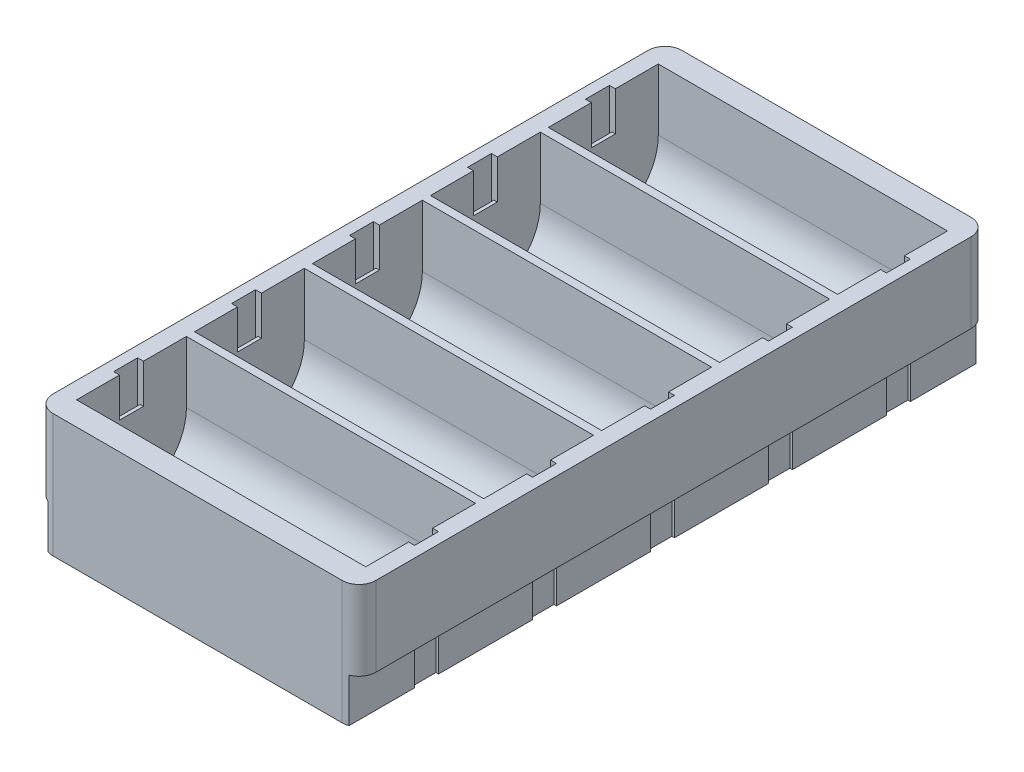
from build123d import *

# Parameters (mm, degrees)
SKETCH_241_W                = 95.8
SKETCH_241_H                = 36.6
EXTRUDE_326_DEPTH           = 36.6
CUT_EXTRUDE_START           = -5
SKETCH_380_R                = 16.3
CUT_EXTRUDE_539_DEPTH       = 85.8
SKETCH_588_W                = 85.8
SKETCH_588_H                = 32.6
CUT_EXTRUDE_850_DEPTH       = 18.3
CUT_EXTRUDE_1245_DEPTH      = 109.888750567
CUT_EXTRUDE_1245_DEPTH_BACK = 109.888750567
SKETCH_902_W                = 0.75
SKETCH_902_H                = 7.1
SKETCH_A_W                  = 7.1
SKETCH_A_H                  = 11.6
CUT_EXTRUDE_A_DEPTH         = 1
SKETCH_B_W                  = 7.1
SKETCH_B_H                  = 11.6
CUT_EXTRUDE_B_DEPTH         = 1
SKETCH_1779_W               = 81.8
SKETCH_1779_H               = 16.6
CUT_EXTRUDE_2059_DEPTH      = 109.888750567
SKETCH_2105_W               = 3.25
SKETCH_2105_H               = 13.1
CUT_EXTRUDE_2527_DEPTH      = 13
PATTERN_LINEAR_2584_COUNT   = 5
PATTERN_LINEAR_2584_PITCH   = 35
SKETCH_2694_W               = 95.8
SKETCH_2694_H               = 36.6
EXTRUDE_2884_DEPTH          = 5
SKETCH_2964_W               = 95.8
SKETCH_2964_H               = 36.6
EXTRUDE_3079_DEPTH          = 5
FILLET_1_R                  = 5
FILLET_2_R                  = 5
FILLET_3_R                  = 5
FILLET_4_R                  = 5
SKETCH_3561_W               = 186.6
SKETCH_3561_H               = 13
CUT_EXTRUDE_3822_DEPTH      = 3.25
SKETCH_4173_W               = 186.6
SKETCH_4173_H               = 13
CUT_EXTRUDE_4352_DEPTH      = 3.25


with BuildPart() as part:
    # Sketch 241 → Extrude 326 (new body)
    with BuildSketch(Plane(origin=(0, 0, 0), x_dir=(1, 0, 0), z_dir=(0, 1, 0))):
        with Locations((-47.9, 18.3)):
            Rectangle(SKETCH_241_W, SKETCH_241_H)
    extrude(amount=EXTRUDE_326_DEPTH)

    # Sketch 380 → Cut-Extrude 539 (cut)
    with BuildSketch(Plane(origin=(0, 0, 0), x_dir=(0, 0, -1), z_dir=(1, 0, 0)).offset(CUT_EXTRUDE_START)):
        with Locations((18.3, 18.3)):
            Circle(SKETCH_380_R)
    extrude(amount=-CUT_EXTRUDE_539_DEPTH, mode=Mode.SUBTRACT)

    # Sketch 588 → Cut-Extrude 850 (cut)
    with BuildSketch(Plane(origin=(0, 36.6, 0), x_dir=(1, 0, 0), z_dir=(0, 1, 0))):
        with Locations((-47.9, 18.3)):
            Rectangle(SKETCH_588_W, SKETCH_588_H)
    extrude(amount=-CUT_EXTRUDE_850_DEPTH, mode=Mode.SUBTRACT)

    # Sketch 902 → Cut-Extrude 1245 (cut, two sides: drawn at the far end of the back side and taken through both)
    with BuildSketch(Plane(origin=(0, 36.6, 0), x_dir=(1, 0, 0), z_dir=(0, 1, 0)).offset(-CUT_EXTRUDE_1245_DEPTH_BACK)):
        with Locations((-92.175, 18.3)):
            Rectangle(SKETCH_902_W, SKETCH_902_H)
        with Locations((-3.625, 18.3)):
            Rectangle(SKETCH_902_W, SKETCH_902_H)
    extrude(amount=CUT_EXTRUDE_1245_DEPTH + CUT_EXTRUDE_1245_DEPTH_BACK, mode=Mode.SUBTRACT)

    # 触点开窗面A → 触点开窗A (cut)
    with BuildSketch(Plane(origin=(-90.8, 0, 0), x_dir=(0, 0, -1), z_dir=(1, 0, 0))):
        with Locations((18.3, 30.8)):
            Rectangle(SKETCH_A_W, SKETCH_A_H)
    extrude(amount=-CUT_EXTRUDE_A_DEPTH, mode=Mode.SUBTRACT)

    # 触点开窗面B → 触点开窗B (cut)
    with BuildSketch(Plane.ZY.offset(5)):
        with Locations((-18.3, 30.8)):
            Rectangle(SKETCH_B_W, SKETCH_B_H)
    extrude(amount=-CUT_EXTRUDE_B_DEPTH, mode=Mode.SUBTRACT)

    # Sketch 1779 → Cut-Extrude 2059 (cut, through all)
    with BuildSketch(Plane.XZ):
        with Locations((-47.9, -18.3)):
            Rectangle(SKETCH_1779_W, SKETCH_1779_H)
    extrude(amount=-CUT_EXTRUDE_2059_DEPTH, mode=Mode.SUBTRACT)

    # Sketch 2105 → Cut-Extrude 2527 (cut)
    with BuildSketch(Plane.XZ):
        with Locations((-94.175, -18.3)):
            Rectangle(SKETCH_2105_W, SKETCH_2105_H)
        with Locations((-1.625, -18.3)):
            Rectangle(SKETCH_2105_W, SKETCH_2105_H)
    extrude(amount=-CUT_EXTRUDE_2527_DEPTH, mode=Mode.SUBTRACT)


with BuildPart() as pattern_linear_2584_1:
    # Pattern Linear 2584: pattern copy
    add(part.part.moved(Location(Vector(0, 0, -1) * (1 * PATTERN_LINEAR_2584_PITCH))))


with BuildPart() as pattern_linear_2584_2:
    # Pattern Linear 2584: pattern copy
    add(part.part.moved(Location(Vector(0, 0, -1) * (2 * PATTERN_LINEAR_2584_PITCH))))


with BuildPart() as pattern_linear_2584_3:
    # Pattern Linear 2584: pattern copy
    add(part.part.moved(Location(Vector(0, 0, -1) * (3 * PATTERN_LINEAR_2584_PITCH))))


with BuildPart() as pattern_linear_2584_4:
    # Pattern Linear 2584: pattern copy
    add(part.part.moved(Location(Vector(0, 0, -1) * (4 * PATTERN_LINEAR_2584_PITCH))))

    # Sketch 2694 → Extrude 2884 (add)
    with BuildSketch(Plane(origin=(0, 0, -176.6), x_dir=(-1, 0, 0), z_dir=(0, 0, -1))):
        with Locations((47.9, 18.3)):
            Rectangle(SKETCH_2694_W, SKETCH_2694_H)
    extrude(amount=EXTRUDE_2884_DEPTH)

    # 圆角3
    fillet_3_edges = [pattern_linear_2584_4.edges().sort_by_distance(p)[0] for p in [
        (-95.8, 18.3, -181.6),
    ]]
    fillet(fillet_3_edges, radius=FILLET_3_R)

    # 圆角4
    fillet_4_edges = [pattern_linear_2584_4.edges().sort_by_distance(p)[0] for p in [
        (0, 18.3, -181.6),
    ]]
    fillet(fillet_4_edges, radius=FILLET_4_R)


with BuildPart() as part_1:
    add(part.part)

    # Sketch 2964 → Extrude 3079 (add)
    with BuildSketch(Plane.XY):
        with Locations((-47.9, 18.3)):
            Rectangle(SKETCH_2964_W, SKETCH_2964_H)
    extrude(amount=EXTRUDE_3079_DEPTH)

    # 圆角1
    fillet_1_edges = [part_1.edges().sort_by_distance(p)[0] for p in [
        (-95.8, 18.3, 5),
    ]]
    fillet(fillet_1_edges, radius=FILLET_1_R)

    # 圆角2
    fillet_2_edges = [part_1.edges().sort_by_distance(p)[0] for p in [
        (0, 18.3, 5),
    ]]
    fillet(fillet_2_edges, radius=FILLET_2_R)


with BuildPart() as cut_extrude_3822_tool:
    # Sketch 3561 → Cut-Extrude 3822 (new body)
    with BuildSketch(Plane.ZY.offset(95.8)):
        with Locations((-88.3, 6.5)):
            Rectangle(SKETCH_3561_W, SKETCH_3561_H)
    extrude(amount=-CUT_EXTRUDE_3822_DEPTH)


with BuildPart() as part_2:
    add(part_1.part)

    # Cut-Extrude 3822: cut by cut_extrude_3822_tool
    add(cut_extrude_3822_tool.part, mode=Mode.SUBTRACT)


with BuildPart() as pattern_linear_2584_1_1:
    add(pattern_linear_2584_1.part)

    # Cut-Extrude 3822: cut by cut_extrude_3822_tool
    add(cut_extrude_3822_tool.part, mode=Mode.SUBTRACT)


with BuildPart() as pattern_linear_2584_2_1:
    add(pattern_linear_2584_2.part)

    # Cut-Extrude 3822: cut by cut_extrude_3822_tool
    add(cut_extrude_3822_tool.part, mode=Mode.SUBTRACT)


with BuildPart() as pattern_linear_2584_3_1:
    add(pattern_linear_2584_3.part)

    # Cut-Extrude 3822: cut by cut_extrude_3822_tool
    add(cut_extrude_3822_tool.part, mode=Mode.SUBTRACT)


with BuildPart() as pattern_linear_2584_4_1:
    add(pattern_linear_2584_4.part)

    # Cut-Extrude 3822: cut by cut_extrude_3822_tool
    add(cut_extrude_3822_tool.part, mode=Mode.SUBTRACT)


with BuildPart() as cut_extrude_4352_tool:
    # Sketch 4173 → Cut-Extrude 4352 (new body)
    with BuildSketch(Plane(origin=(0, 0, 0), x_dir=(0, 0, -1), z_dir=(1, 0, 0))):
        with Locations((88.3, 6.5)):
            Rectangle(SKETCH_4173_W, SKETCH_4173_H)
    extrude(amount=-CUT_EXTRUDE_4352_DEPTH)


with BuildPart() as part_3:
    add(part_2.part)

    # Cut-Extrude 4352: cut by cut_extrude_4352_tool
    add(cut_extrude_4352_tool.part, mode=Mode.SUBTRACT)


with BuildPart() as pattern_linear_2584_1_2:
    add(pattern_linear_2584_1_1.part)

    # Cut-Extrude 4352: cut by cut_extrude_4352_tool
    add(cut_extrude_4352_tool.part, mode=Mode.SUBTRACT)


with BuildPart() as pattern_linear_2584_2_2:
    add(pattern_linear_2584_2_1.part)

    # Cut-Extrude 4352: cut by cut_extrude_4352_tool
    add(cut_extrude_4352_tool.part, mode=Mode.SUBTRACT)


with BuildPart() as pattern_linear_2584_3_2:
    add(pattern_linear_2584_3_1.part)

    # Cut-Extrude 4352: cut by cut_extrude_4352_tool
    add(cut_extrude_4352_tool.part, mode=Mode.SUBTRACT)


with BuildPart() as pattern_linear_2584_4_2:
    add(pattern_linear_2584_4_1.part)

    # Cut-Extrude 4352: cut by cut_extrude_4352_tool
    add(cut_extrude_4352_tool.part, mode=Mode.SUBTRACT)


with BuildPart() as pattern_linear_2584_1_3:
    add(pattern_linear_2584_1_2.part)

    # Combine 5S: union Pattern Linear 2584_2, Pattern Linear 2584_3, Pattern Linear 2584_4, part
    add(pattern_linear_2584_2_2.part)
    add(pattern_linear_2584_3_2.part)
    add(pattern_linear_2584_4_2.part)
    add(part_3.part)


solid = pattern_linear_2584_1_3.part
